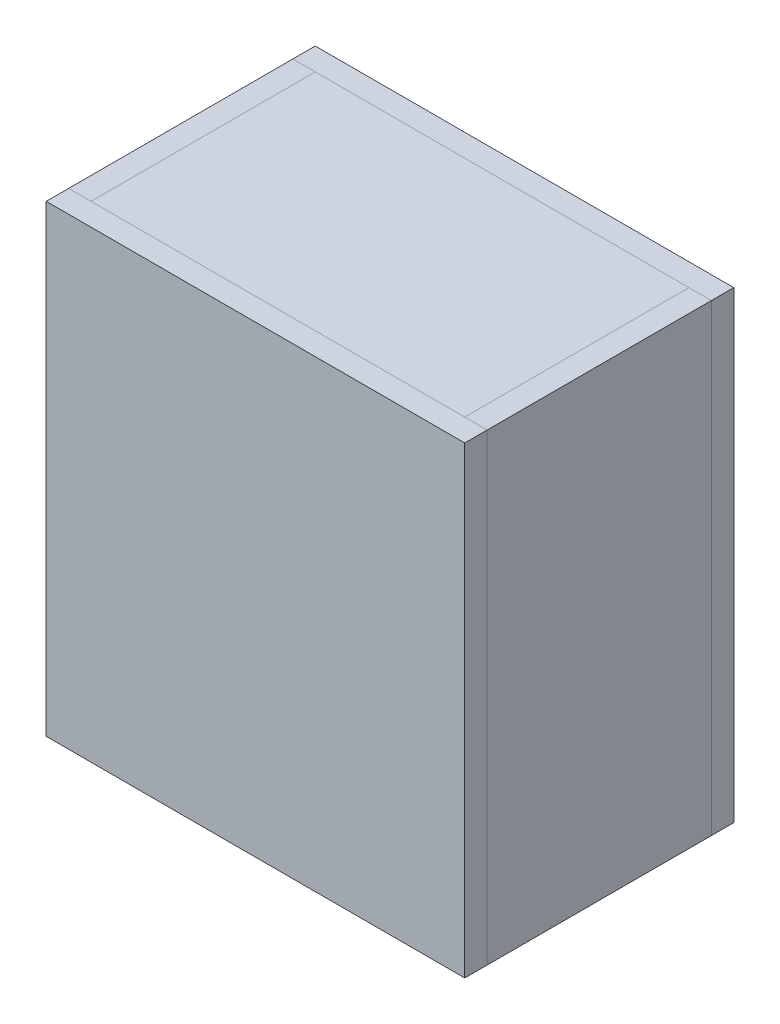
from build123d import *

# Parameters (mm, degrees)
CROQUIS3_W                = 310
CROQUIS3_H                = 280
SALIENTE_EXTRUIR1_DEPTH   = 15
CROQUIS4_W                = 15
CROQUIS4_H                = 310
SALIENTE_EXTRUIR2_DEPTH   = 150
SALIENTE_EXTRUIR2_2_DEPTH = 150
CROQUIS4_3_W              = 250
CROQUIS4_3_H              = 15
SALIENTE_EXTRUIR3_DEPTH   = 150
SALIENTE_EXTRUIR3_2_DEPTH = 150
SALIENTE_EXTRUIR4_DEPTH   = 15
CROQUIS7_W                = 220
CROQUIS7_H                = 10
CROQUIS7_W_2              = 216.686186971
SALIENTE_EXTRUIR5_DEPTH   = 167


with BuildPart() as part:
    # Croquis3 → Saliente-Extruir1 (new body)
    with BuildSketch(Plane(origin=(0, 0, 0), x_dir=(0, 1, 0), z_dir=(0, 0, 1))):
        with Locations((155, 140)):
            Rectangle(CROQUIS3_W, CROQUIS3_H)
    extrude(amount=SALIENTE_EXTRUIR1_DEPTH)


with BuildPart() as body_2:
    # Croquis4 → Saliente-Extruir2 (new body)
    with BuildSketch(Plane.XY.offset(15)):
        with Locations((-272.5, 155)):
            Rectangle(CROQUIS4_W, CROQUIS4_H)
    extrude(amount=SALIENTE_EXTRUIR2_DEPTH)


with BuildPart() as body_3:
    # Croquis4 → Saliente-Extruir2 2 (new body)
    with BuildSketch(Plane.XY.offset(15)):
        with Locations((-7.5, 155)):
            Rectangle(CROQUIS4_W, CROQUIS4_H)
    extrude(amount=SALIENTE_EXTRUIR2_2_DEPTH)

    # Croquis7 → Saliente-Extruir5 (add)
    with BuildSketch(Plane(origin=(-15, 0, 0), x_dir=(0, -1, 0), z_dir=(-1, 0, 0))):
        with Locations((-157.021140195, 110)):
            Rectangle(CROQUIS7_W, CROQUIS7_H)
        with Locations((-158.67804671, 50)):
            Rectangle(CROQUIS7_W_2, CROQUIS7_H)
    extrude(amount=SALIENTE_EXTRUIR5_DEPTH)


with BuildPart() as body_4:
    # Croquis4<3> → Saliente-Extruir3 (new body)
    with BuildSketch(Plane.XY.offset(15)):
        with Locations((-140, 302.5)):
            Rectangle(CROQUIS4_3_W, CROQUIS4_3_H)
    extrude(amount=SALIENTE_EXTRUIR3_DEPTH)


with BuildPart() as body_5:
    # Croquis4<3> → Saliente-Extruir3 2 (new body)
    with BuildSketch(Plane.XY.offset(15)):
        with Locations((-140, 7.5)):
            Rectangle(CROQUIS4_3_W, CROQUIS4_3_H)
    extrude(amount=SALIENTE_EXTRUIR3_2_DEPTH)


with BuildPart() as body_6:
    # Croquis5 → Saliente-Extruir4 (new body)
    with BuildSketch(Plane.XY.offset(165)):
        Polygon((-15, 0), (0, 0), (0, 310), (-15, 310), (-265, 310), (-280, 310), (-280, 0), (-265, 0), align=None)
    extrude(amount=SALIENTE_EXTRUIR4_DEPTH)


solid = Compound([part.part, body_2.part, body_3.part, body_4.part, body_5.part, body_6.part])
